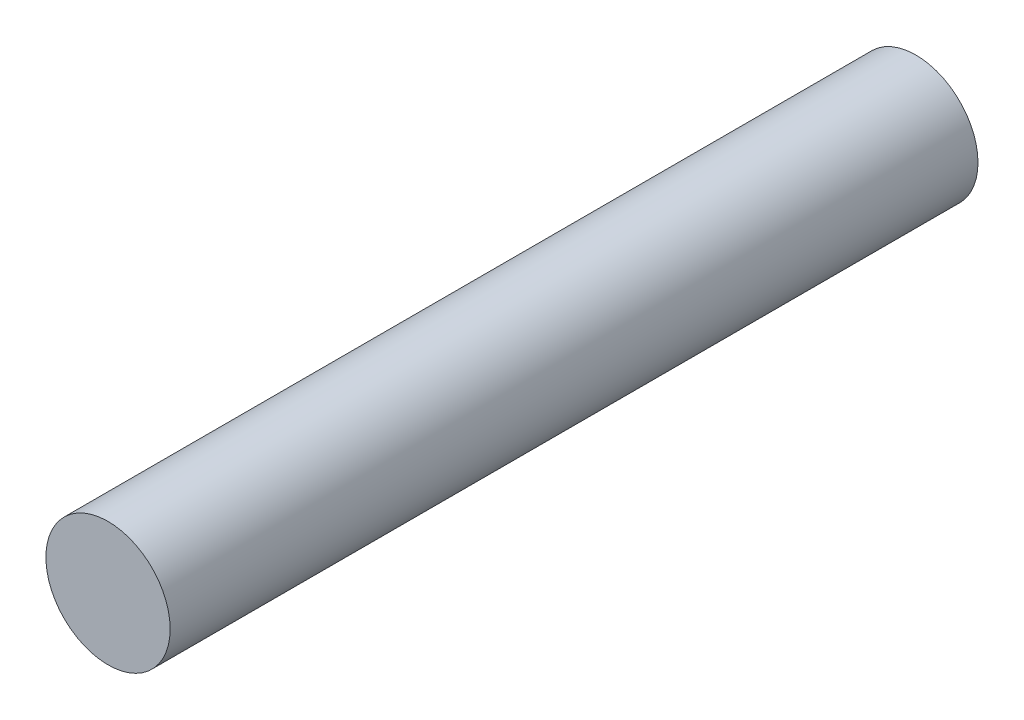
from build123d import *

# Parameters (mm, degrees)
ESQUISSE1_R        = 5
BOSS_EXTRU_1_DEPTH = 65


with BuildPart() as part:
    # Esquisse1 → Boss.-Extru.1 (new body)
    with BuildSketch(Plane.XY):
        Circle(ESQUISSE1_R)
    extrude(amount=BOSS_EXTRU_1_DEPTH)


solid = part.part
